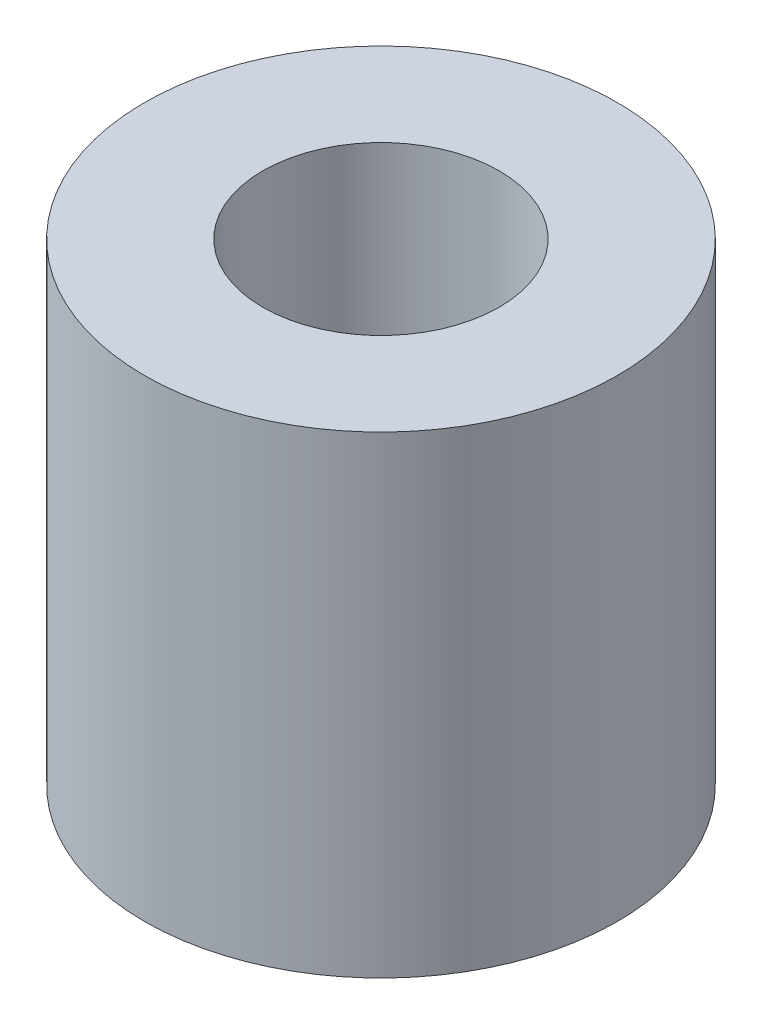
from build123d import *

# Parameters (mm, degrees)
SKETCH2_R           = 40
SKETCH2_R_2         = 20
BOSS_EXTRUDE1_DEPTH = 80


with BuildPart() as part:
    # Sketch2 → Boss-Extrude1 (new body)
    with BuildSketch(Plane(origin=(0, 0, 0), x_dir=(1, 0, 0), z_dir=(0, 1, 0))):
        with Locations(Location((0, 0, 0), (0, 0, 270))):
            Circle(SKETCH2_R)
        with Locations(Location((0, 0, 0), (0, 0, 270))):
            Circle(SKETCH2_R_2, mode=Mode.SUBTRACT)
    extrude(amount=-BOSS_EXTRUDE1_DEPTH)


solid = part.part
